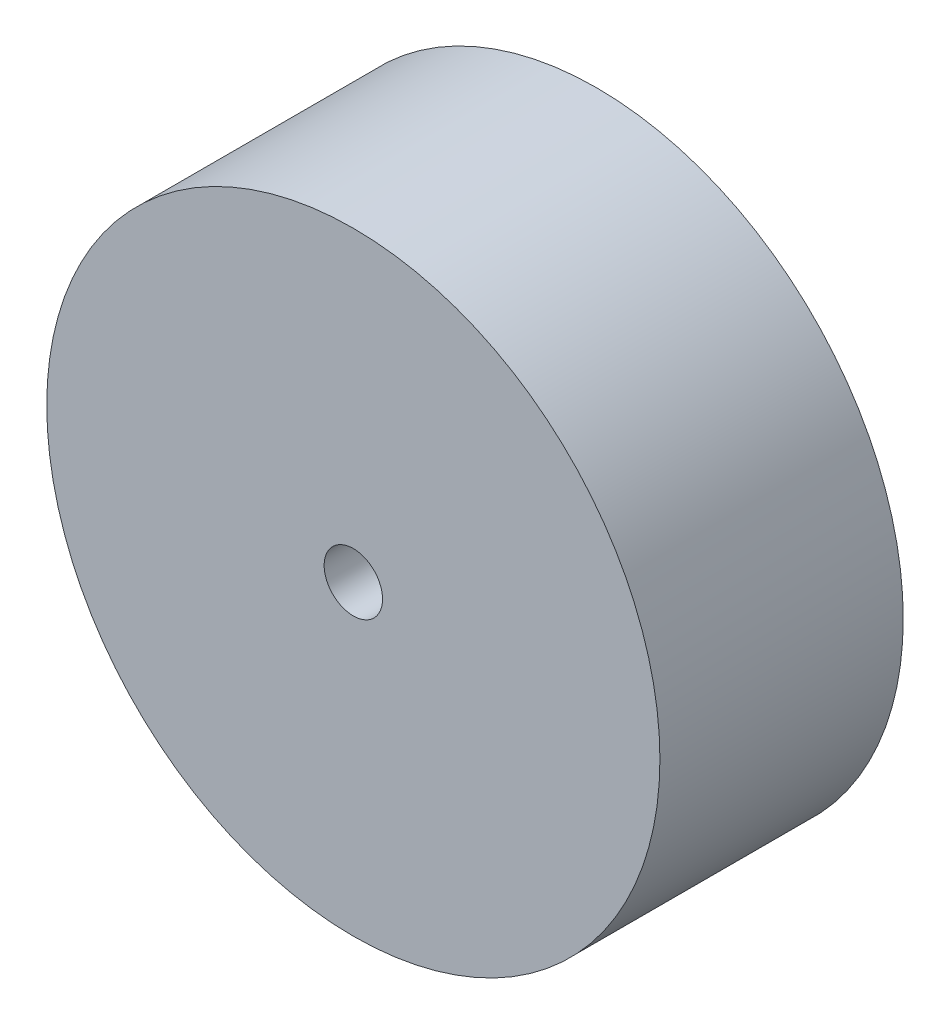
from build123d import *

# Parameters (mm, degrees)
ESQUISSE1_R             = 31.5
BOSS_EXTRU_1_DEPTH      = 25
ESQUISSE2_R             = 3
ENL_V_MAT_EXTRU_1_DEPTH = 52.083265362


with BuildPart() as part:
    # Esquisse1 → Boss.-Extru.1 (new body)
    with BuildSketch(Plane.XY):
        Circle(ESQUISSE1_R)
    extrude(amount=BOSS_EXTRU_1_DEPTH)

    # Esquisse2 → Enlèv. mat.-Extru.1 (cut, through all)
    with BuildSketch(Plane.XY.offset(25)):
        Circle(ESQUISSE2_R)
    extrude(amount=-ENL_V_MAT_EXTRU_1_DEPTH, mode=Mode.SUBTRACT)


solid = part.part
